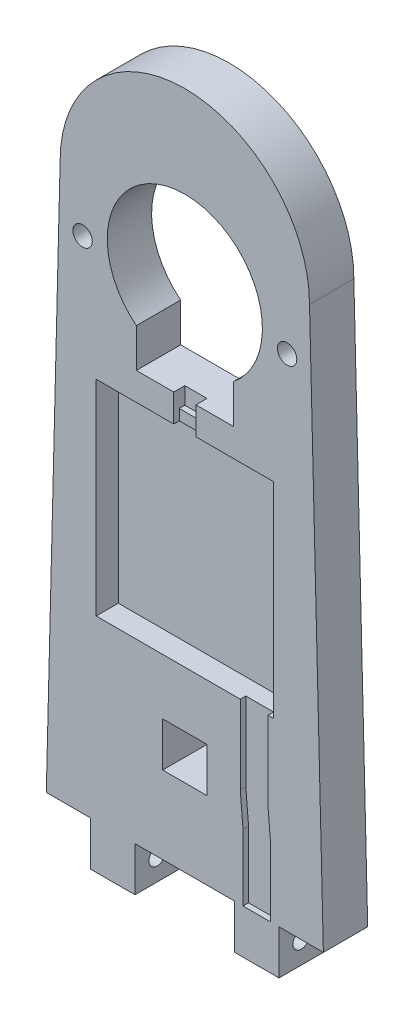
from build123d import *

# Parameters (mm, degrees)
ARM_BOSS_EXTRUDE1_DEPTH                    = 8
STEPPER_CUT_EXTRUDE1_DEPTH                 = 8
CABLE_CUT_EXTRUDE2_DEPTH                   = 1
ULN2003_MODULE_CUT_EXTRUDE3_DEPTH          = 4
SKETCH6_W                                  = 8
SKETCH6_H                                  = 8
PUZZLE_SLOT_BOSS_EXTRUDE2_DEPTH            = 8
SKETCH7_R                                  = 1.75
MOUNTING_HOLES_CUT_EXTRUDE4_DEPTH          = 8
PUZZLE_SLOT_SCREW_HOLES_CUT_EXTRUDE5_REACH = 118.155
SKETCH8_R                                  = 1.5
SKETCH10_W                                 = 4
SKETCH10_H                                 = 3.063353071
CABLE_OUTPUT_CUT_EXTRUDE6_DEPTH            = 1
SIDE_PUZZLE_SLOT_CUT_EXTRUDE7_DEPTH        = 8
CABLE_LOWER_CUT_EXTRUDE8_DEPTH             = 1


with BuildPart() as part:
    # Sketch2 → Arm Boss-Extrude1 (new body)
    with BuildSketch(Plane.XY):
        with BuildLine():
            Line((-22.5, 0), (-25, -100))
            Line((-25, -100), (0, -100))
            Line((0, -100), (25, -100))
            Line((25, -100), (22.5, 0))
            ThreePointArc((22.5, 0), (0, 22.5), (-22.5, 0))
        make_face()
    extrude(amount=-ARM_BOSS_EXTRUDE1_DEPTH)

    # Sketch3 → Stepper Cut-Extrude1 (cut)
    with BuildSketch(Plane.XY):
        with BuildLine():
            Line((-8.75, -18.928746497), (-8.75, -25.928746497))
            Line((-8.75, -25.928746497), (0, -25.928746497))
            Line((0, -25.928746497), (8.75, -25.928746497))
            Line((8.75, -25.928746497), (8.75, -18.928746497))
            ThreePointArc((8.75, -18.928746497), (0, 6), (-8.75, -18.928746497))
        make_face()
    extrude(amount=-STEPPER_CUT_EXTRUDE1_DEPTH, mode=Mode.SUBTRACT)

    # Sketch4 → Cable Cut-Extrude2 (cut)
    with BuildSketch(Plane.XY):
        Polygon((-2, -25.928746497), (2, -25.928746497), (2, -30.928746497), (0, -30.928746497), (-2, -30.928746497), align=None)
    extrude(amount=-CABLE_CUT_EXTRUDE2_DEPTH, mode=Mode.SUBTRACT)

    # Sketch5 → ULN2003 Module Cut-Extrude3 (cut)
    with BuildSketch(Plane.XY):
        Polygon((-16, -30.928746497), (16, -30.928746497), (16, -67.928746497), (0, -67.928746497), (-16, -67.928746497), align=None)
    extrude(amount=-ULN2003_MODULE_CUT_EXTRUDE3_DEPTH, mode=Mode.SUBTRACT)

    # Sketch6 → Puzzle Slot Boss-Extrude2 (add)
    with BuildSketch(Plane.XZ.offset(100)):
        with Locations((-13, -4)):
            Rectangle(SKETCH6_W, SKETCH6_H)
        with Locations((13, -4)):
            Rectangle(SKETCH6_W, SKETCH6_H)
    extrude(amount=PUZZLE_SLOT_BOSS_EXTRUDE2_DEPTH)

    # Sketch7 → Mounting Holes Cut-Extrude4 (cut)
    with BuildSketch(Plane.XY):
        with Locations((-18.45, -9.75)):
            Circle(SKETCH7_R)
        with Locations((18.45, -9.75)):
            Circle(SKETCH7_R)
    extrude(amount=-MOUNTING_HOLES_CUT_EXTRUDE4_DEPTH, mode=Mode.SUBTRACT)

    # Puzzle Slot Screw Holes Cut-Extrude5: up to this face of the body (flat: up to its plane)
    puzzle_slot_screw_holes_cut_extrude5_end = Plane(part.part.faces().sort_by_distance((17, -104, -4))[0])
    # Sketch8 → Puzzle Slot Screw Holes Cut-Extrude5 (cut, up to the picked face)
    with BuildSketch(Plane.ZY.offset(17), mode=Mode.PRIVATE) as puzzle_slot_screw_holes_cut_extrude5_sk1:
        with Locations(Location((-4, -104, 0), (0, 0, 270))):
            Circle(SKETCH8_R)
    puzzle_slot_screw_holes_cut_extrude5_tool1 = split(extrude(puzzle_slot_screw_holes_cut_extrude5_sk1.sketch, amount=-PUZZLE_SLOT_SCREW_HOLES_CUT_EXTRUDE5_REACH, mode=Mode.PRIVATE), bisect_by=puzzle_slot_screw_holes_cut_extrude5_end, keep=Keep.BOTH, mode=Mode.PRIVATE)
    add(puzzle_slot_screw_holes_cut_extrude5_tool1.solids().sort_by(Axis((-17, -104, -4), (1, 0, 0)))[0], mode=Mode.SUBTRACT)

    # Sketch10 → Cable Output Cut-Extrude6 (cut)
    with BuildSketch(Plane.XY.offset(-1)):
        with Locations((0, -27.460423033)):
            Rectangle(SKETCH10_W, SKETCH10_H)
    extrude(amount=-CABLE_OUTPUT_CUT_EXTRUDE6_DEPTH, mode=Mode.SUBTRACT)

    # Sketch11 → Side Puzzle Slot Cut-Extrude7 (cut)
    with BuildSketch(Plane.XY):
        Polygon((-4, -86), (4, -86), (4, -78), (0, -78), (-4, -78), align=None)
    extrude(amount=-SIDE_PUZZLE_SLOT_CUT_EXTRUDE7_DEPTH, mode=Mode.SUBTRACT)

    # Sketch12 → Cable Lower Cut-Extrude8 (cut)
    with BuildSketch(Plane.XY):
        Polygon((15, -67.928746497), (10, -67.928746497), (10, -82.103104923), (10.5, -88.003309516), (10.5, -100), (15.5, -100), (15.5, -88.003309516), (15, -82.103104923), align=None)
    extrude(amount=-CABLE_LOWER_CUT_EXTRUDE8_DEPTH, mode=Mode.SUBTRACT)


solid = part.part
